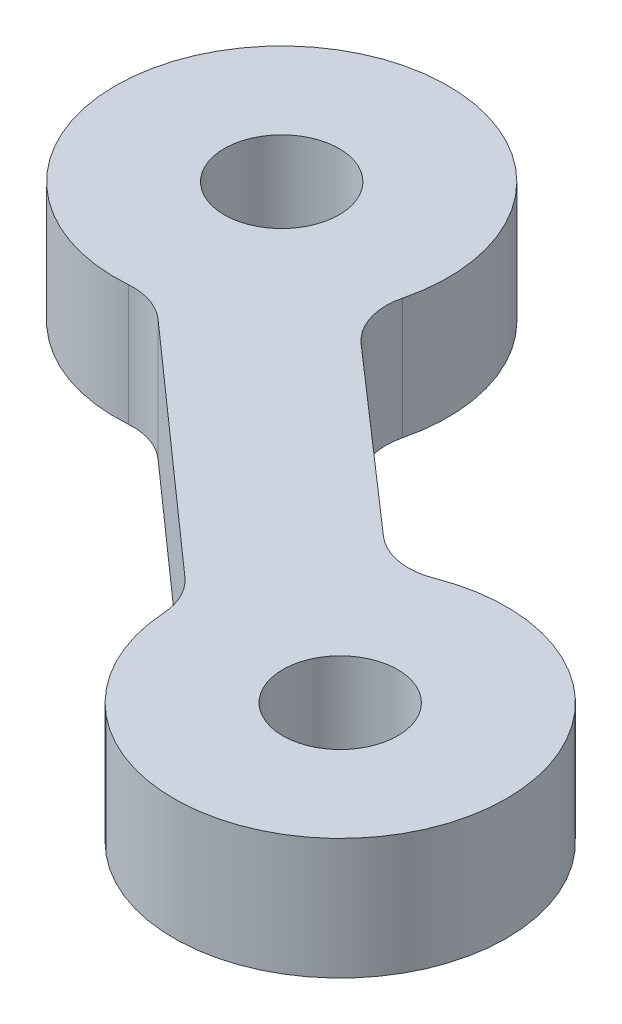
from build123d import *

# Parameters (mm, degrees)
SKETCH2_R           = 1.9
BOSS_EXTRUDE1_DEPTH = 4
FILLET1_R           = 2


with BuildPart() as part:
    # Sketch2 → Boss-Extrude1 (new body)
    with BuildSketch(Plane(origin=(0, 0, 0), x_dir=(1, 0, 0), z_dir=(0, 1, 0))):
        with BuildLine():
            Line((94.955116322, 38.172302232), (87.02771465, 45.104892713))
            ThreePointArc((87.02771465, 45.104892713), (78.69699813, 51.863103241), (83.294746555, 42.171098459))
            Line((83.294746555, 42.171098459), (92.503166469, 34.006299468))
            ThreePointArc((92.503166469, 34.006299468), (102.726842439, 30.793598232), (94.955116322, 38.172302232))
        make_face()
        with Locations(Location((82.095552315, 47.538773298, 0), (0, 0, 270))):
            Circle(SKETCH2_R, mode=Mode.SUBTRACT)
        with Locations(Location((97.986880619, 33.583358427, 0), (0, 0, 270))):
            Circle(SKETCH2_R, mode=Mode.SUBTRACT)
    extrude(amount=BOSS_EXTRUDE1_DEPTH)

    # Fillet1
    fillet1_edges = [part.edges().sort_by_distance(p)[0] for p in [
        (83.294746555, 2, -42.171098459),
        (87.02771465, 2, -45.104892713),
        (94.955116322, 2, -38.172302232),
        (92.503166469, 2, -34.006299468),
    ]]
    fillet(fillet1_edges, radius=FILLET1_R)


solid = part.part
